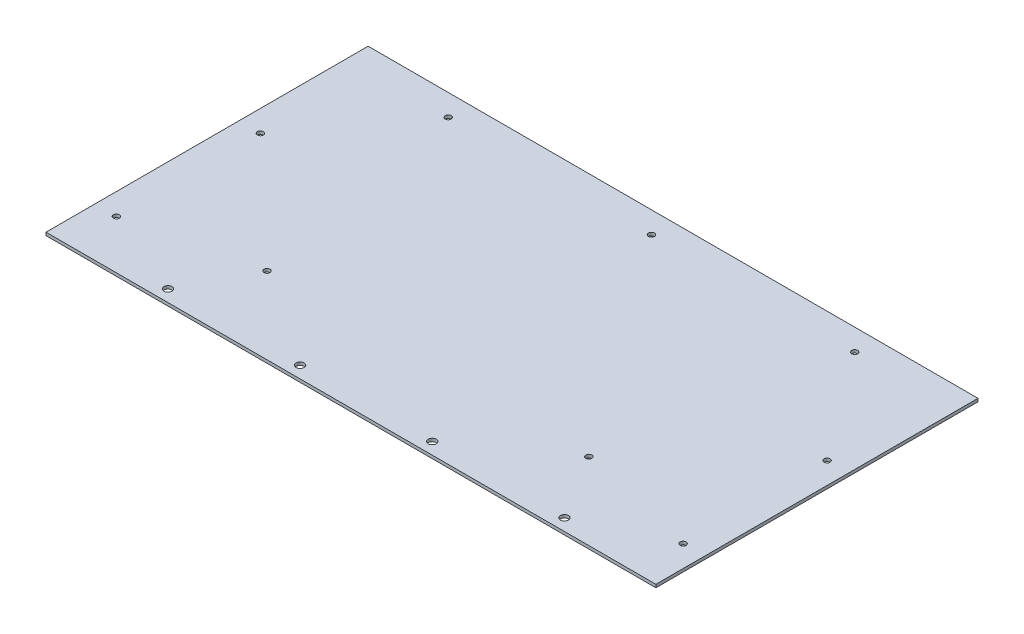
from build123d import *

# Parameters (mm, degrees)
SKETCH1_W            = 457.2
SKETCH1_H            = 2.286
BOSS_EXTRUDE1_DEPTH  = 238.315200026
SKETCH2_W            = 457.2
SKETCH2_H            = 2.286
BOSS_EXTRUDE2_DEPTH  = 3.175
SKETCH9_R            = 3
CUT_EXTRUDE10_DEPTH  = 2.54
LPATTERN1_COUNT      = 4
LPATTERN1_PITCH      = 99.06
M4_CLEARANCE_HOLE1_D = 4.5


with BuildPart() as part:
    # Sketch1 → Boss-Extrude1 (new body)
    with BuildSketch(Plane.XY):
        Rectangle(SKETCH1_W, SKETCH1_H)
    extrude(amount=BOSS_EXTRUDE1_DEPTH)

    # Sketch2 → Boss-Extrude2 (add)
    with BuildSketch(Plane(origin=(0, 0, 0), x_dir=(-1, 0, 0), z_dir=(0, 0, -1))):
        Rectangle(SKETCH2_W, SKETCH2_H)
    extrude(amount=BOSS_EXTRUDE2_DEPTH)

    # Sketch9 → Cut-Extrude10 (cut)
    with BuildSketch(Plane(origin=(0, 1.143, 0), x_dir=(1, 0, 0), z_dir=(0, 1, 0))):
        with Locations(Location((-146.05, -229.425200026, 0), (0, 0, 270))):
            Circle(SKETCH9_R)
    cut_extrude10 = extrude(amount=-CUT_EXTRUDE10_DEPTH, mode=Mode.SUBTRACT)

    # LPattern1: Cut-Extrude10 ×4
    with Locations(*[(i * LPATTERN1_PITCH, 0, 0) for i in range(1, LPATTERN1_COUNT)]):
        add(cut_extrude10, mode=Mode.SUBTRACT)

    # M4 Clearance Hole1 (through all)
    with Locations(Plane.XZ.offset(1.143)):
        with Locations((-212.419, 93.774823778), (-152.4, 13.0175), (0, 13.0175), (152.4, 13.0175), (212.419, 93.774823778), (212.419, 201.724823778), (120.65, 180.586), (-120.65, 180.586), (-212.419, 201.724823778)):
            Hole(M4_CLEARANCE_HOLE1_D / 2)


solid = part.part
